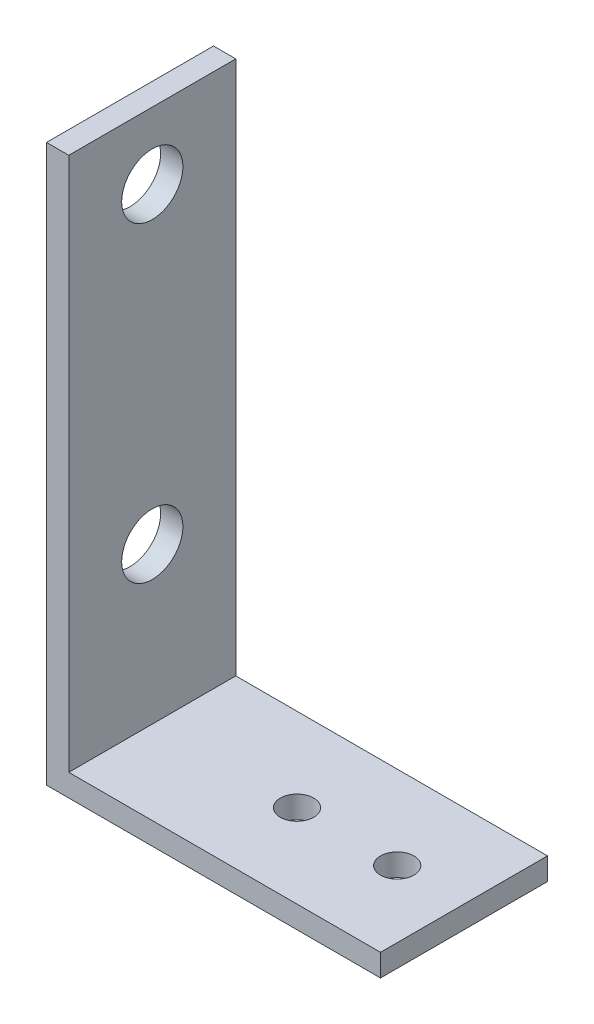
from build123d import *

# Parameters (mm, degrees)
ESTRUSIONE_ESTRUSIONE1_DEPTH = 15
SCHIZZO2_R                   = 2.75
TAGLIO_ESTRUSIONE1_DEPTH     = 15
SCHIZZO3_R                   = 1.5
TAGLIO_ESTRUSIONE2_DEPTH     = 15


with BuildPart() as part:
    # Schizzo1 → Estrusione-Estrusione1 (new body)
    with BuildSketch(Plane.XY):
        Polygon((0, 0), (-30, 0), (-30, 50), (-28, 50), (-28, 2), (0, 2), align=None)
    extrude(amount=ESTRUSIONE_ESTRUSIONE1_DEPTH)

    # Schizzo2 → Taglio-Estrusione1 (cut)
    with BuildSketch(Plane.ZY.offset(30)):
        with Locations((7.5, 44)):
            Circle(SCHIZZO2_R)
        with Locations((7.5, 16)):
            Circle(SCHIZZO2_R)
    extrude(amount=-TAGLIO_ESTRUSIONE1_DEPTH, mode=Mode.SUBTRACT)

    # Schizzo3 → Taglio-Estrusione2 (cut)
    with BuildSketch(Plane.XZ):
        with Locations((-6, 7.5)):
            Circle(SCHIZZO3_R)
        with Locations((-15, 7.5)):
            Circle(SCHIZZO3_R)
    extrude(amount=-TAGLIO_ESTRUSIONE2_DEPTH, mode=Mode.SUBTRACT)


solid = part.part
